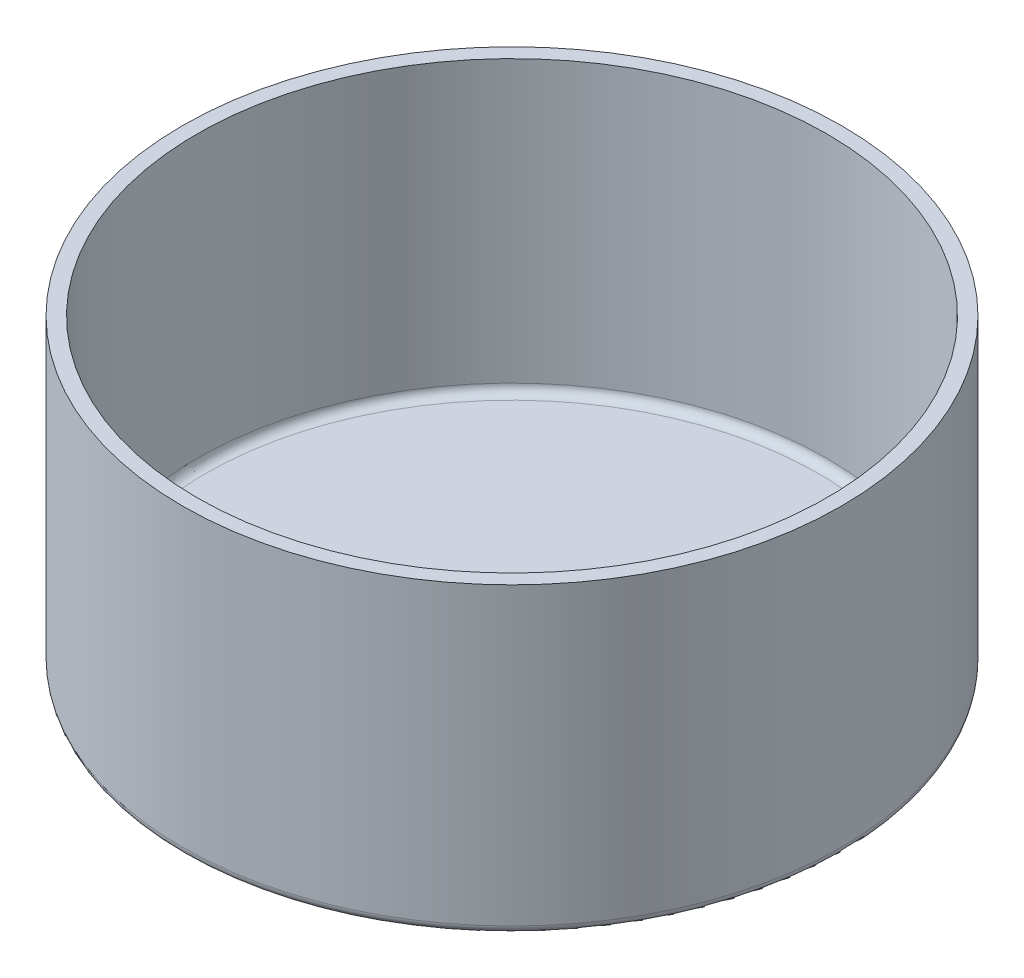
from build123d import *

# Parameters (mm, degrees)
CROQUIS1_R              = 11.375
SALIENTE_EXTRUIR1_DEPTH = 0.5
CROQUIS2_R              = 11.375
CROQUIS2_R_2            = 10.875
SALIENTE_EXTRUIR2_DEPTH = 10
REDONDEO1_R             = 0.3
REDONDEO2_R             = 0.3


with BuildPart() as part:
    # Croquis1 → Saliente-Extruir1 (new body)
    with BuildSketch(Plane(origin=(0, 0, 0), x_dir=(1, 0, 0), z_dir=(0, 1, 0))):
        with Locations(Location((0, 0, 0), (0, 0, 270))):
            Circle(CROQUIS1_R)
    extrude(amount=SALIENTE_EXTRUIR1_DEPTH)

    # Croquis2 → Saliente-Extruir2 (add)
    with BuildSketch(Plane(origin=(0, 0.5, 0), x_dir=(1, 0, 0), z_dir=(0, 1, 0))):
        with Locations(Location((0, 0, 0), (0, 0, 270))):
            Circle(CROQUIS2_R)
        with Locations(Location((0, 0, 0), (0, 0, 270))):
            Circle(CROQUIS2_R_2, mode=Mode.SUBTRACT)
    extrude(amount=SALIENTE_EXTRUIR2_DEPTH)

    # Redondeo1
    redondeo1_edges = [part.edges().sort_by_distance(p)[0] for p in [
        (0, 0.5, -10.875),
    ]]
    fillet(redondeo1_edges, radius=REDONDEO1_R)

    # Redondeo2
    redondeo2_edges = [part.edges().sort_by_distance(p)[0] for p in [
        (0, 0, -11.375),
    ]]
    fillet(redondeo2_edges, radius=REDONDEO2_R)


solid = part.part
